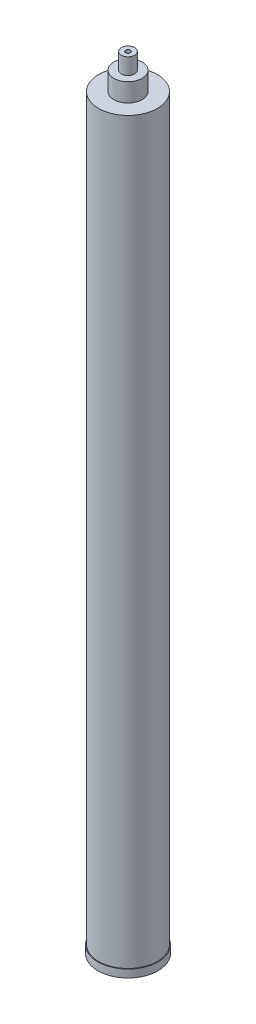
from build123d import *

# Parameters (mm, degrees)
SKETCH1_R                   = 49.25
MAINTUBE_DEPTH              = 1239
SKETCH2_R                   = 50.45
NOZZLERETAINER_DEPTH        = 13
SKETCH3_R                   = 23.75
MOUNTSHOULDER_DEPTH         = 31
SKETCH4_R                   = 11.125
MOUNTNECK_DEPTH             = 27.2
F_3_8_16_TAPPED_HOLE1_D     = 7.9375
F_3_8_16_TAPPED_HOLE1_DEPTH = 27.3
F_3_8_16_TAPPED_HOLE1_TIP   = 2.384665582


with BuildPart() as part:
    # Sketch1 → mainTube (new body)
    with BuildSketch(Plane(origin=(0, 0, 0), x_dir=(1, 0, 0), z_dir=(0, 1, 0))):
        with Locations(Location((0, 0, 0), (0, 0, 270))):
            Circle(SKETCH1_R)
    extrude(amount=MAINTUBE_DEPTH)

    # Sketch2 → nozzleRetainer (add)
    with BuildSketch(Plane.XZ):
        with Locations(Location((0, 0, 0), (0, 0, 90))):
            Circle(SKETCH2_R)
    extrude(amount=NOZZLERETAINER_DEPTH)

    # Sketch3 → mountShoulder (add)
    with BuildSketch(Plane(origin=(0, 1239, 0), x_dir=(1, 0, 0), z_dir=(0, 1, 0))):
        with Locations(Location((0, 0, 0), (0, 0, 270))):
            Circle(SKETCH3_R)
    extrude(amount=MOUNTSHOULDER_DEPTH)

    # Sketch4 → mountNeck (add)
    with BuildSketch(Plane(origin=(0, 1270, 0), x_dir=(1, 0, 0), z_dir=(0, 1, 0))):
        with Locations(Location((0, 0, 0), (0, 0, 270))):
            Circle(SKETCH4_R)
    extrude(amount=MOUNTNECK_DEPTH)

    # 3/8-16 Tapped Hole1
    with Locations(Plane(origin=(0, 1297.2, 0), x_dir=(1, 0, 0), z_dir=(0, 1, 0))):
        with Locations((0, 0)):
            Hole(F_3_8_16_TAPPED_HOLE1_D / 2, depth=F_3_8_16_TAPPED_HOLE1_DEPTH)
            with Locations((0, 0, -(F_3_8_16_TAPPED_HOLE1_DEPTH + F_3_8_16_TAPPED_HOLE1_TIP / 2))):  # 118° drill point
                Cone(0, F_3_8_16_TAPPED_HOLE1_D / 2, F_3_8_16_TAPPED_HOLE1_TIP, mode=Mode.SUBTRACT)


solid = part.part
